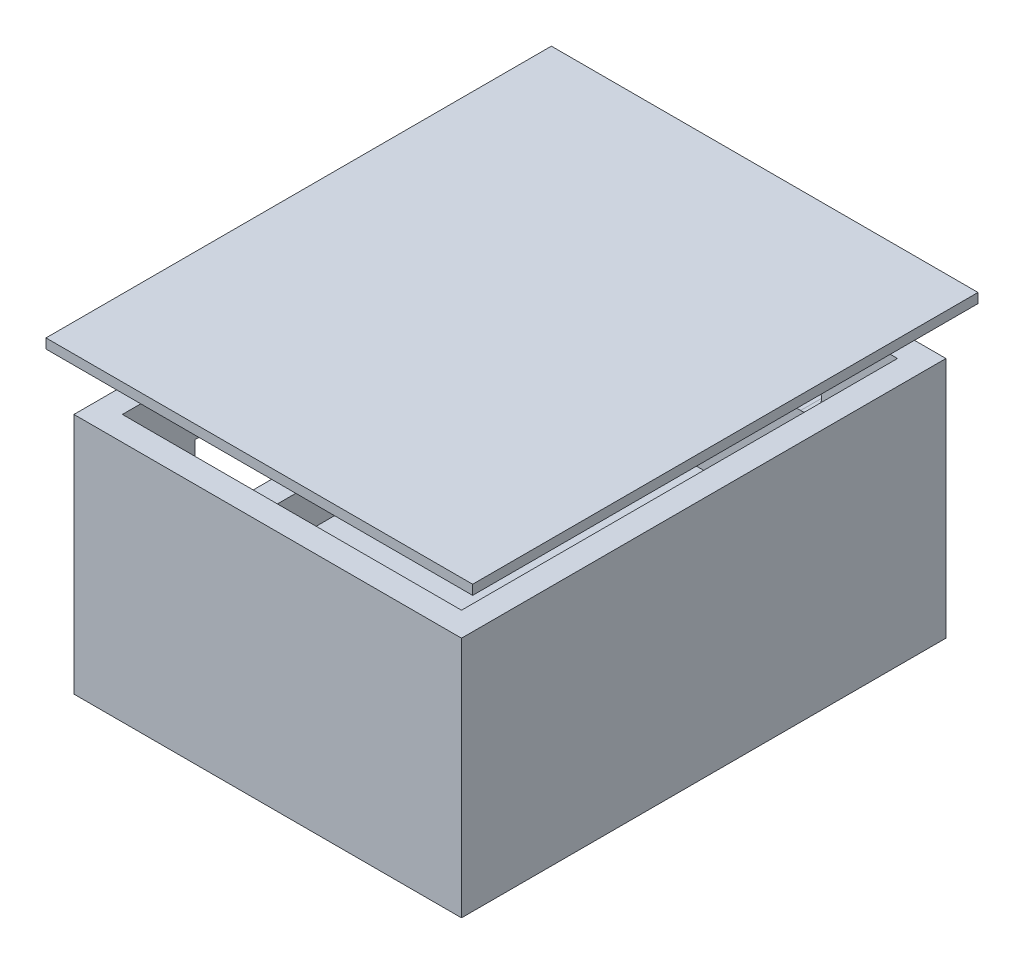
from build123d import *

# Parameters (mm, degrees)
SKETCH1_W           = 101.6
SKETCH1_H           = 127
BOSS_EXTRUDE1_DEPTH = 63.5
SKETCH2_W           = 88.9
SKETCH2_H           = 114.3
CUT_EXTRUDE1_DEPTH  = 50.8
SKETCH3_W           = 76.2
SKETCH3_H           = 25.4
CUT_EXTRUDE2_DEPTH  = 50.8
SKETCH4_W           = 111.844383113
SKETCH4_H           = 132.482449899
BOSS_EXTRUDE2_DEPTH = 2.54
SKETCH5_W           = 98.128383113
SKETCH5_H           = 118.766449899
BOSS_EXTRUDE3_DEPTH = 2.54
CUT_EXTRUDE3_DEPTH  = 7.62


with BuildPart() as part:
    # Sketch1 → Boss-Extrude1 (new body)
    with BuildSketch(Plane(origin=(0, 0, 0), x_dir=(1, 0, 0), z_dir=(0, 1, 0))):
        with Locations((50.8, 63.5)):
            Rectangle(SKETCH1_W, SKETCH1_H)
    extrude(amount=BOSS_EXTRUDE1_DEPTH)

    # Sketch2 → Cut-Extrude1 (cut)
    with BuildSketch(Plane(origin=(0, 63.5, 0), x_dir=(1, 0, 0), z_dir=(0, 1, 0))):
        with Locations((50.8, 63.5)):
            Rectangle(SKETCH2_W, SKETCH2_H)
    extrude(amount=-CUT_EXTRUDE1_DEPTH, mode=Mode.SUBTRACT)

    # Sketch3 → Cut-Extrude2 (cut)
    with BuildSketch(Plane.ZY):
        with Locations((-63.5, 35.56)):
            Rectangle(SKETCH3_W, SKETCH3_H)
    extrude(amount=-CUT_EXTRUDE2_DEPTH, mode=Mode.SUBTRACT)

    # Sketch7 → Cut-Extrude3 (cut)
    with BuildSketch(Plane(origin=(0, 0, -127), x_dir=(-1, 0, 0), z_dir=(0, 0, -1))):
        with BuildLine():
            Line((-31.75, 39.002999395), (-69.85, 39.002999395))
            ThreePointArc((-69.85, 39.002999395), (-75.297000605, 44.45), (-69.85, 49.897000605))
            Line((-69.85, 49.897000605), (-31.75, 49.897000605))
            ThreePointArc((-31.75, 49.897000605), (-26.302999395, 44.45), (-31.75, 39.002999395))
        make_face()
    extrude(amount=-CUT_EXTRUDE3_DEPTH, mode=Mode.SUBTRACT)


with BuildPart() as body_2:
    # Sketch4 → Boss-Extrude2 (new body)
    with BuildSketch(Plane(origin=(0, 78.74, 0), x_dir=(1, 0, 0), z_dir=(0, 1, 0))):
        with Locations((50.125096624, 64.712636769)):
            Rectangle(SKETCH4_W, SKETCH4_H)
    extrude(amount=-BOSS_EXTRUDE2_DEPTH)

    # Sketch5 → Boss-Extrude3 (add)
    with BuildSketch(Plane.XZ.offset(-76.2)):
        with Locations((50.125096623, -64.712636769)):
            Rectangle(SKETCH5_W, SKETCH5_H)
    extrude(amount=BOSS_EXTRUDE3_DEPTH)


solid = Compound([part.part, body_2.part])
